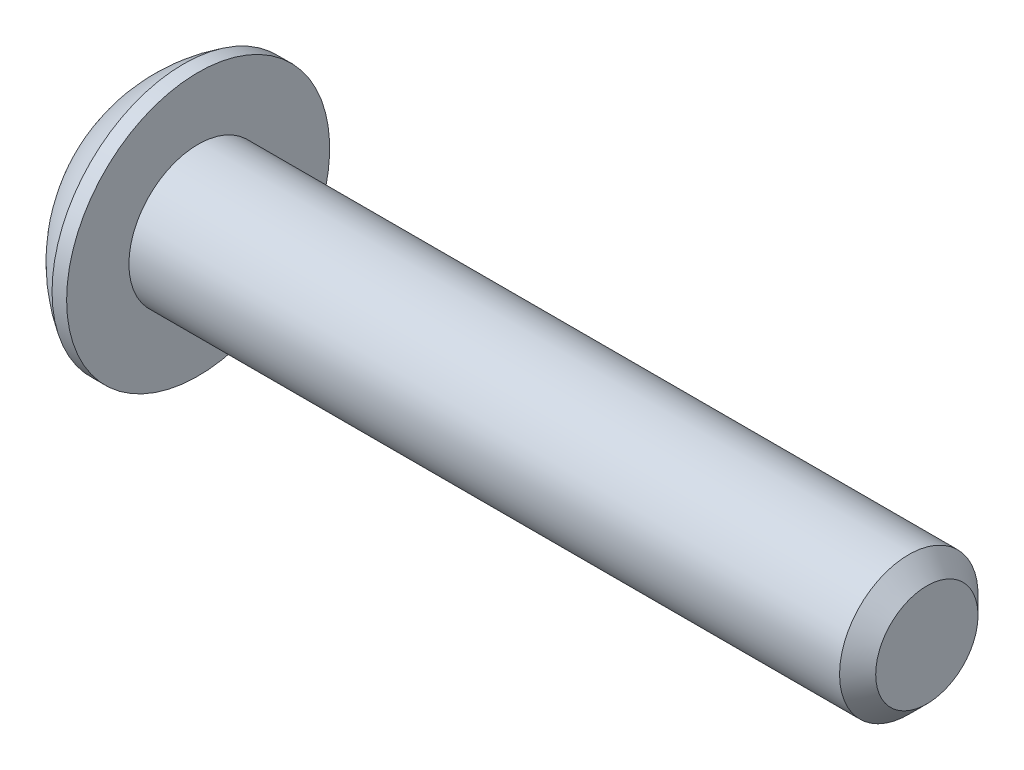
from build123d import *

# Parameters (mm, degrees)
HEX_2_DEPTH = 1.778


with BuildPart() as part:
    # BodySke → BaseBody (revolve)
    with BuildSketch(Plane.XY, mode=Mode.PRIVATE) as basebody_sk:
        with BuildLine():
            Line((27.9654, 0), (27.9654, 1.78308))
            Line((27.9654, 1.78308), (27.33548, 2.413))
            Line((27.33548, 2.413), (2.5654, 2.413))
            Line((2.5654, 2.413), (2.5654, 4.5847))
            Line((2.5654, 4.5847), (2.0574, 4.5847))
            ThreePointArc((2.0574, 4.5847), (0.860923645, 3.589105441), (0, 2.29235))
            Line((0, 2.29235), (0, 0))
            Line((0, 0), (27.9654, 0))
        make_face()
    revolve(basebody_sk.sketch.rotate(Axis((0, 0, 0), (1, 0, 0)), 90), axis=Axis((0, 0, 0), (1, 0, 0)))

    # Sketch2 → PreBroach (revolve, cut)
    with BuildSketch(Plane.XY, mode=Mode.PRIVATE) as prebroach_sk:
        Polygon((0, 1.5875), (1.778, 1.5875), (2.694543552, 0), (0, 0), align=None)
    revolve(prebroach_sk.sketch.rotate(Axis((0, 0, 0), (1, 0, 0)), 90), axis=Axis((0, 0, 0), (1, 0, 0)), mode=Mode.SUBTRACT)

    # Sketch3 → Hex 2 (cut)
    with BuildSketch(Plane(origin=(0, 0, 0), x_dir=(0, 0, -1), z_dir=(1, 0, 0))):
        Polygon((-1.5875, -0.916543552), (-1.5875, 0.916543552), (0, 1.833087105), (1.5875, 0.916543552), (1.5875, -0.916543552), (0, -1.833087105), align=None)
    extrude(amount=HEX_2_DEPTH, mode=Mode.SUBTRACT)


solid = part.part
